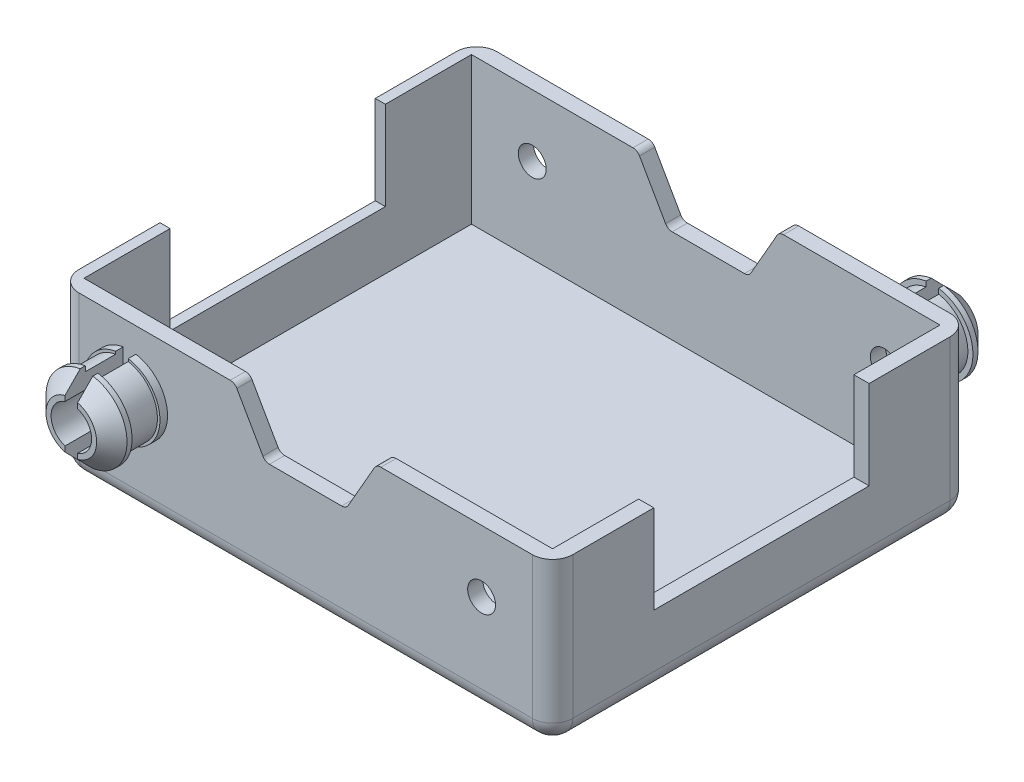
from build123d import *

# Parameters (mm, degrees)
SKETCH1_W                                    = 97.5
SKETCH1_H                                    = 82.5
BOSS_EXTRUDE1_DEPTH                          = 32
SHELL1_T                                     = -3
FILLET1_R                                    = 4
CUT_EXTRUDE1_START                           = -1
SKETCH4_W                                    = 76.5
SKETCH4_H                                    = 29
CUT_EXTRUDE1_DEPTH                           = 83.5
CUT_EXTRUDE2_REACH                           = 133.668
SKETCH5_W                                    = 42.5
SKETCH5_H                                    = 17.5
CUT_EXTRUDE3_REACH                           = 133.668
FILLET2_R                                    = 1.5
CUT_EXTRUDE4_START                           = -82.5
SKETCH7_R                                    = 2.75
CUT_EXTRUDE4_DEPTH                           = 82.5
SKETCH9_R                                    = 7.5
SKETCH9_R_2                                  = 2.75
BOSS_EXTRUDE3_DEPTH                          = 1.5
CUT_EXTRUDE5_REACH                           = 133.668
SKETCH11_W                                   = 2.5
SKETCH11_H                                   = 16
MIRROR2_AT_THE_SECOND_PLANE_COPY_1_SKETC_R   = 7.5
MIRROR2_AT_THE_SECOND_PLANE_COPY_1_SKETC_R_2 = 2.75
MIRROR2_AT_THE_SECOND_PLANE_COPY_1_DEPTH     = 1.5
MIRROR2_AT_THE_SECOND_PLANE_COPY_3_REACH     = 133.668
MIRROR2_AT_THE_SECOND_PLANE_COPY_3_SKETC_W   = 2.5
MIRROR2_AT_THE_SECOND_PLANE_COPY_3_SKETC_H   = 16
SKETCH12_W                                   = 25.238507428
SKETCH12_H                                   = 22.458767107
CUT_EXTRUDE6_DEPTH                           = 11.5
CUT_EXTRUDE7_REACH                           = 141.163
SKETCH13_W                                   = 31.509123874
SKETCH13_H                                   = 19.339493898


with BuildPart() as part:
    # Sketch1 → Boss-Extrude1 (new body)
    with BuildSketch(Plane(origin=(0, 0, 0), x_dir=(1, 0, 0), z_dir=(0, 1, 0))):
        with Locations((48.75, 41.25)):
            Rectangle(SKETCH1_W, SKETCH1_H)
    extrude(amount=BOSS_EXTRUDE1_DEPTH)

    # Shell1
    shell1_openings = [part.faces().sort_by_distance(p)[0] for p in [
        (48.75, 32, -41.25),
    ]]
    offset(amount=SHELL1_T, openings=shell1_openings, kind=Kind.INTERSECTION)

    # Fillet1
    fillet1_edges = [part.edges().sort_by_distance(p)[0] for p in [
        (48.75, 0, -82.5),
        (97.5, 0, -41.25),
        (48.75, 0, 0),
        (0, 0, -41.25),
        (0, 16, -82.5),
        (97.5, 16, -82.5),
        (97.5, 16, 0),
        (0, 16, 0),
    ]]
    fillet(fillet1_edges, radius=FILLET1_R)

    # Sketch4 → Cut-Extrude1 (cut)
    with BuildSketch(Plane(origin=(3, 0, 0), x_dir=(0, 0, -1), z_dir=(1, 0, 0)).offset(CUT_EXTRUDE1_START)):
        with Locations((41.25, 17.5)):
            Rectangle(SKETCH4_W, SKETCH4_H)
    extrude(amount=CUT_EXTRUDE1_DEPTH, mode=Mode.SUBTRACT)

    # Cut-Extrude2: up to this face of the body (flat: up to its plane)
    cut_extrude2_end = Plane(part.part.faces().sort_by_distance((0, 18, -41.25))[0])
    # Sketch5 → Cut-Extrude2 (cut, up to the picked face)
    with BuildSketch(Plane(origin=(97.5, 0, 0), x_dir=(0, 0, -1), z_dir=(1, 0, 0)), mode=Mode.PRIVATE) as cut_extrude2_sk1:
        with Locations((41.25, 23.25)):
            Rectangle(SKETCH5_W, SKETCH5_H)
    cut_extrude2_tool1 = split(extrude(cut_extrude2_sk1.sketch, amount=-CUT_EXTRUDE2_REACH, mode=Mode.PRIVATE), bisect_by=cut_extrude2_end, keep=Keep.BOTH, mode=Mode.PRIVATE)
    add(cut_extrude2_tool1.solids().sort_by(Axis((97.5, 23.25, -41.25), (-1, 0, 0)))[0], mode=Mode.SUBTRACT)

    # Cut-Extrude3: up to this face of the body (flat: up to its plane)
    cut_extrude3_end = Plane(part.part.faces().sort_by_distance((48.75, 18, -82.5))[0])
    # Sketch6 → Cut-Extrude3 (cut, up to the picked face)
    with BuildSketch(Plane.XY, mode=Mode.PRIVATE) as cut_extrude3_sk1:
        Polygon((40.75, 21.5), (56.75, 21.5), (62.75, 32), (34.75, 32), align=None)
    cut_extrude3_tool1 = split(extrude(cut_extrude3_sk1.sketch, amount=-CUT_EXTRUDE3_REACH, mode=Mode.PRIVATE), bisect_by=cut_extrude3_end, keep=Keep.BOTH, mode=Mode.PRIVATE)
    add(cut_extrude3_tool1.solids().sort_by(Axis((48.75, 27.227273, 0), (0, 0, -1)))[0], mode=Mode.SUBTRACT)

    # Fillet2
    fillet2_edges = [part.edges().sort_by_distance(p)[0] for p in [
        (40.75, 21.5, -1.5),
        (34.75, 32, -1.5),
        (62.75, 32, -1.5),
        (56.75, 21.5, -1.5),
        (40.75, 21.5, -81),
        (34.75, 32, -81),
        (62.75, 32, -81),
        (56.75, 21.5, -81),
    ]]
    fillet(fillet2_edges, radius=FILLET2_R)

    # Sketch7 → Cut-Extrude4 (cut)
    with BuildSketch(Plane.XY.offset(CUT_EXTRUDE4_START)):
        with Locations((14, 19.75)):
            Circle(SKETCH7_R)
        with Locations((83.5, 19.75)):
            Circle(SKETCH7_R)
    extrude(amount=CUT_EXTRUDE4_DEPTH, mode=Mode.SUBTRACT)

    # Sketch9 → Boss-Extrude3 (add)
    with BuildSketch(Plane.XY):
        with Locations(Location((14, 19.75, 0), (0, 0, 180))):
            Circle(SKETCH9_R)
        with Locations((14, 19.75)):
            Circle(SKETCH9_R_2, mode=Mode.SUBTRACT)
    boss_extrude3 = extrude(amount=BOSS_EXTRUDE3_DEPTH)

    # Sketch10 → Revolve1 (revolve)
    with BuildSketch(Plane.ZY.offset(-14), mode=Mode.PRIVATE) as revolve1_sk:
        Polygon((11.5, 24.75), (8.5, 27.75), (7.5, 27.75), (7.5, 26.75), (1.5, 26.75), (1.5, 23.75), (11.5, 23.75), align=None)
    revolve1 = revolve(revolve1_sk.sketch.rotate(Axis((14, 19.75, 0), (0, 0, 1)), 90), axis=Axis((14, 19.75, 0), (0, 0, 1)))

    # Cut-Extrude5: up to this face of the body (flat: up to its plane)
    cut_extrude5_end = Plane(part.part.faces().sort_by_distance((18.141421356, 19.75, 11.5))[0])
    # Sketch11 → Cut-Extrude5 (cut, up to the picked face)
    with BuildSketch(Plane.XY, mode=Mode.PRIVATE) as cut_extrude5_sk1:
        with Locations((14, 19.75)):
            Rectangle(SKETCH11_W, SKETCH11_H)
    cut_extrude5_tool1 = split(extrude(cut_extrude5_sk1.sketch, amount=CUT_EXTRUDE5_REACH, mode=Mode.PRIVATE), bisect_by=cut_extrude5_end, keep=Keep.BOTH, mode=Mode.PRIVATE)
    cut_extrude5 = cut_extrude5_tool1.solids().sort_by(Axis((14, 19.75, 0), (0, 0, 1)))[0]
    add(cut_extrude5, mode=Mode.SUBTRACT)

    # Mirror2: Boss-Extrude3, Revolve1, Cut-Extrude5 across plane
    add(boss_extrude3.mirror(Plane.ZY.offset(-48.25)))
    add(revolve1.mirror(Plane.ZY.offset(-48.25)))
    add(cut_extrude5.mirror(Plane.ZY.offset(-48.25)), mode=Mode.SUBTRACT)

    # Mirror2 at the second plane: Boss-Extrude3, Revolve1, Cut-Extrude5 across plane
    add(boss_extrude3.mirror(Plane.XY.offset(-41.25)))
    add(revolve1.mirror(Plane.XY.offset(-41.25)))
    add(cut_extrude5.mirror(Plane.XY.offset(-41.25)), mode=Mode.SUBTRACT)

    # Mirror2 at the second plane copy 1 sketc → Mirror2 at the second plane copy 1 (add)
    with BuildSketch(Plane(origin=(96.5, 0, -82.5), x_dir=(-1, 0, 0), z_dir=(0, 0, -1))):
        with Locations(Location((14, 19.75, 0), (0, 0, 180))):
            Circle(MIRROR2_AT_THE_SECOND_PLANE_COPY_1_SKETC_R)
        with Locations((14, 19.75)):
            Circle(MIRROR2_AT_THE_SECOND_PLANE_COPY_1_SKETC_R_2, mode=Mode.SUBTRACT)
    extrude(amount=MIRROR2_AT_THE_SECOND_PLANE_COPY_1_DEPTH)

    # Mirror2 at the second plane copy 2 sketc → Mirror2 at the second plane copy 2 (revolve)
    with BuildSketch(Plane(origin=(82.5, 0, -82.5), x_dir=(0, 0, -1), z_dir=(1, 0, 0))):
        Polygon((11.5, 24.75), (8.5, 27.75), (7.5, 27.75), (7.5, 26.75), (1.5, 26.75), (1.5, 23.75), (11.5, 23.75), align=None)
    revolve(axis=Axis((82.5, 19.75, -82.5), (0, 0, -1)))

    # Mirror2 at the second plane copy 3: up to this face of the body (flat: up to its plane)
    mirror2_at_the_second_plane_copy_3_end = Plane(part.part.faces().sort_by_distance((78.358578644, 19.75, -94))[0])
    # Mirror2 at the second plane copy 3 sketc → Mirror2 at the second plane copy 3 (cut, up to the picked face)
    with BuildSketch(Plane(origin=(96.5, 0, -82.5), x_dir=(-1, 0, 0), z_dir=(0, 0, -1)), mode=Mode.PRIVATE) as mirror2_at_the_second_plane_copy_3_sk1:
        with Locations((14, 19.75)):
            Rectangle(MIRROR2_AT_THE_SECOND_PLANE_COPY_3_SKETC_W, MIRROR2_AT_THE_SECOND_PLANE_COPY_3_SKETC_H)
    mirror2_at_the_second_plane_copy_3_tool1 = split(extrude(mirror2_at_the_second_plane_copy_3_sk1.sketch, amount=MIRROR2_AT_THE_SECOND_PLANE_COPY_3_REACH, mode=Mode.PRIVATE), bisect_by=mirror2_at_the_second_plane_copy_3_end, keep=Keep.BOTH, mode=Mode.PRIVATE)
    add(mirror2_at_the_second_plane_copy_3_tool1.solids().sort_by(Axis((82.5, 19.75, -82.5), (0, 0, -1)))[0], mode=Mode.SUBTRACT)

    # Sketch12 → Cut-Extrude6 (cut)
    with BuildSketch(Plane(origin=(0, 0, -82.5), x_dir=(-1, 0, 0), z_dir=(0, 0, -1))):
        with Locations((-16.619253714, 19.183530238)):
            Rectangle(SKETCH12_W, SKETCH12_H)
    extrude(amount=CUT_EXTRUDE6_DEPTH, mode=Mode.SUBTRACT)

    # Sketch13 → Cut-Extrude7 (cut, up to next)
    with BuildSketch(Plane.XY, mode=Mode.PRIVATE) as cut_extrude7_sk1:
        with Locations((77.745438063, 20.1193122)):
            Rectangle(SKETCH13_W, SKETCH13_H)
    cut_extrude7_tool1 = extrude(cut_extrude7_sk1.sketch, amount=CUT_EXTRUDE7_REACH, mode=Mode.PRIVATE) & part.part
    add(cut_extrude7_tool1.solids().sort_by_distance((77.745438, 20.119312, 0))[0], mode=Mode.SUBTRACT)
    add(cut_extrude7_tool1.solids().sort_by_distance((77.745438, 20.119312, 0))[1], mode=Mode.SUBTRACT)


solid = part.part
